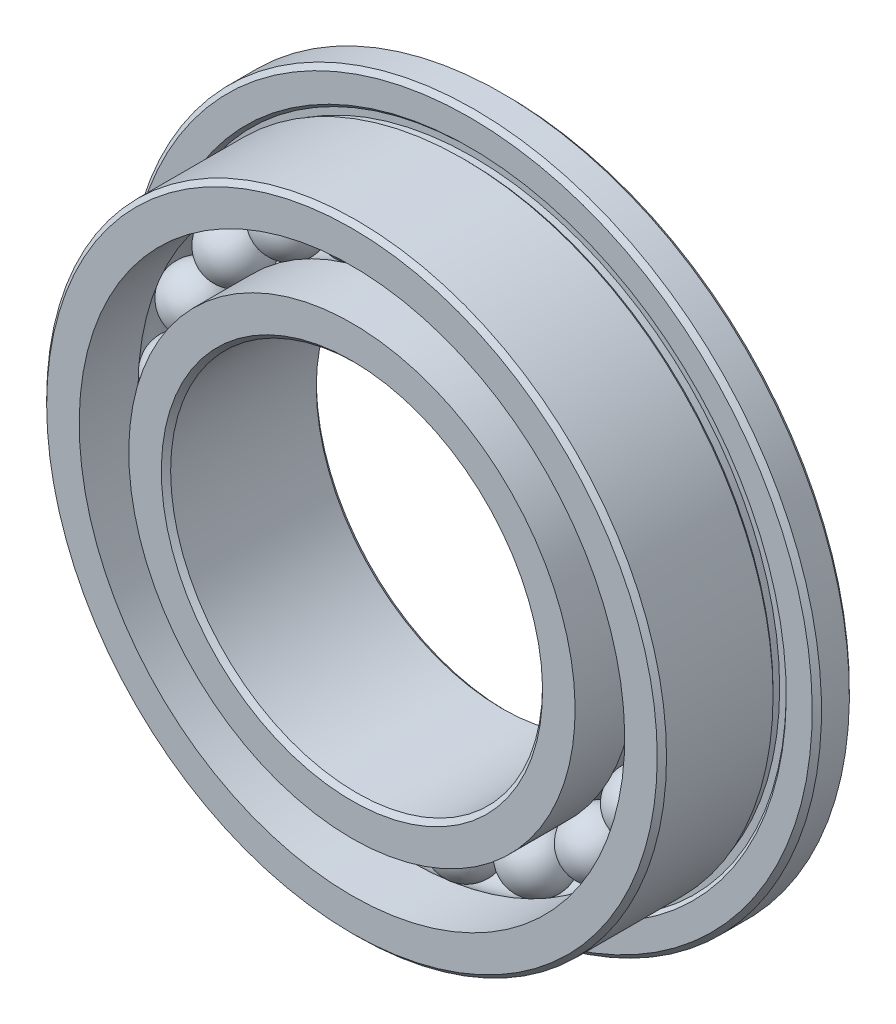
from build123d import *

# Parameters (mm, degrees)
FILLET1_SIZE      = 0.075
FILLET2_SIZE      = 0.075
CIRPATTERN3_COUNT = 21


with BuildPart() as part:
    # Sketch2 → Revolve1 (revolve)
    with BuildSketch(Plane(origin=(0, 0, 0), x_dir=(0, 0, -1), z_dir=(1, 0, 0)), mode=Mode.PRIVATE) as revolve1_sk:
        with BuildLine():
            Line((1.25, 5.6), (0.65, 5.6))
            Line((0.65, 5.6), (0.65, 5.106066017))
            Line((0.65, 5.106066017), (0.703033009, 5.053033009))
            Line((0.703033009, 5.053033009), (0.703033009, 4.946966991))
            Line((0.703033009, 4.946966991), (0.596966991, 4.946966991))
            Line((0.596966991, 4.946966991), (0.543933983, 5))
            Line((0.543933983, 5), (-1.25, 5))
            Line((-1.25, 5), (-1.25, 4.4))
            Line((-1.25, 4.4), (-0.3, 4.4))
            ThreePointArc((-0.3, 4.4), (0, 4.5), (0.3, 4.4))
            Line((0.3, 4.4), (1.25, 4.4))
            Line((1.25, 4.4), (1.25, 5.6))
        make_face()
        with BuildLine():
            Line((1.25, 3), (-1.25, 3))
            Line((-1.25, 3), (-1.25, 3.6))
            Line((-1.25, 3.6), (-0.3, 3.6))
            ThreePointArc((-0.3, 3.6), (0, 3.5), (0.3, 3.6))
            Line((0.3, 3.6), (1.25, 3.6))
            Line((1.25, 3.6), (1.25, 3))
        make_face()
    revolve(revolve1_sk.sketch.rotate(Axis((0, 0, 0), (0, 0, -1)), 180), axis=Axis((0, 0, 0), (0, 0, -1)))

    # Fillet1
    fillet1_edges = [part.edges().sort_by_distance(p)[0] for p in [
        (0, 5, 1.25),
        (0, 5.6, -1.25),
        (0, 5.6, -0.65),
    ]]
    chamfer(fillet1_edges, length=FILLET1_SIZE)

    # Fillet2
    fillet2_edges = [part.edges().sort_by_distance(p)[0] for p in [
        (0, 3, -1.25),
        (0, 3, 1.25),
    ]]
    chamfer(fillet2_edges, length=FILLET2_SIZE)


with BuildPart() as body_2:
    # Sketch7 → Revolve3 (revolve)
    with BuildSketch(Plane.XY):
        with BuildLine():
            Line((0, 4.5), (0, 3.5))
            ThreePointArc((0, 3.5), (-0.5, 4), (0, 4.5))
        make_face()
    revolve(axis=Axis((0, 4.5, 0), (0, -1, 0)))


with BuildPart() as cirpattern3_1:
    # CirPattern3: pattern copy
    add(body_2.part.rotate(Axis((0, 0, 0), (0, 0, 1)), 1 * 360 / CIRPATTERN3_COUNT))


with BuildPart() as cirpattern3_2:
    # CirPattern3: pattern copy
    add(body_2.part.rotate(Axis((0, 0, 0), (0, 0, 1)), 2 * 360 / CIRPATTERN3_COUNT))


with BuildPart() as cirpattern3_3:
    # CirPattern3: pattern copy
    add(body_2.part.rotate(Axis((0, 0, 0), (0, 0, 1)), 3 * 360 / CIRPATTERN3_COUNT))


with BuildPart() as cirpattern3_4:
    # CirPattern3: pattern copy
    add(body_2.part.rotate(Axis((0, 0, 0), (0, 0, 1)), 4 * 360 / CIRPATTERN3_COUNT))


with BuildPart() as cirpattern3_5:
    # CirPattern3: pattern copy
    add(body_2.part.rotate(Axis((0, 0, 0), (0, 0, 1)), 5 * 360 / CIRPATTERN3_COUNT))


with BuildPart() as cirpattern3_6:
    # CirPattern3: pattern copy
    add(body_2.part.rotate(Axis((0, 0, 0), (0, 0, 1)), 6 * 360 / CIRPATTERN3_COUNT))


with BuildPart() as cirpattern3_7:
    # CirPattern3: pattern copy
    add(body_2.part.rotate(Axis((0, 0, 0), (0, 0, 1)), 7 * 360 / CIRPATTERN3_COUNT))


with BuildPart() as cirpattern3_8:
    # CirPattern3: pattern copy
    add(body_2.part.rotate(Axis((0, 0, 0), (0, 0, 1)), 8 * 360 / CIRPATTERN3_COUNT))


with BuildPart() as cirpattern3_9:
    # CirPattern3: pattern copy
    add(body_2.part.rotate(Axis((0, 0, 0), (0, 0, 1)), 9 * 360 / CIRPATTERN3_COUNT))


with BuildPart() as cirpattern3_10:
    # CirPattern3: pattern copy
    add(body_2.part.rotate(Axis((0, 0, 0), (0, 0, 1)), 10 * 360 / CIRPATTERN3_COUNT))


with BuildPart() as cirpattern3_11:
    # CirPattern3: pattern copy
    add(body_2.part.rotate(Axis((0, 0, 0), (0, 0, 1)), 11 * 360 / CIRPATTERN3_COUNT))


with BuildPart() as cirpattern3_12:
    # CirPattern3: pattern copy
    add(body_2.part.rotate(Axis((0, 0, 0), (0, 0, 1)), 12 * 360 / CIRPATTERN3_COUNT))


with BuildPart() as cirpattern3_13:
    # CirPattern3: pattern copy
    add(body_2.part.rotate(Axis((0, 0, 0), (0, 0, 1)), 13 * 360 / CIRPATTERN3_COUNT))


with BuildPart() as cirpattern3_14:
    # CirPattern3: pattern copy
    add(body_2.part.rotate(Axis((0, 0, 0), (0, 0, 1)), 14 * 360 / CIRPATTERN3_COUNT))


with BuildPart() as cirpattern3_15:
    # CirPattern3: pattern copy
    add(body_2.part.rotate(Axis((0, 0, 0), (0, 0, 1)), 15 * 360 / CIRPATTERN3_COUNT))


with BuildPart() as cirpattern3_16:
    # CirPattern3: pattern copy
    add(body_2.part.rotate(Axis((0, 0, 0), (0, 0, 1)), 16 * 360 / CIRPATTERN3_COUNT))


with BuildPart() as cirpattern3_17:
    # CirPattern3: pattern copy
    add(body_2.part.rotate(Axis((0, 0, 0), (0, 0, 1)), 17 * 360 / CIRPATTERN3_COUNT))


with BuildPart() as cirpattern3_18:
    # CirPattern3: pattern copy
    add(body_2.part.rotate(Axis((0, 0, 0), (0, 0, 1)), 18 * 360 / CIRPATTERN3_COUNT))


with BuildPart() as cirpattern3_19:
    # CirPattern3: pattern copy
    add(body_2.part.rotate(Axis((0, 0, 0), (0, 0, 1)), 19 * 360 / CIRPATTERN3_COUNT))


with BuildPart() as cirpattern3_20:
    # CirPattern3: pattern copy
    add(body_2.part.rotate(Axis((0, 0, 0), (0, 0, 1)), 20 * 360 / CIRPATTERN3_COUNT))


solid = Compound([part.part, body_2.part, cirpattern3_1.part, cirpattern3_2.part, cirpattern3_3.part, cirpattern3_4.part, cirpattern3_5.part, cirpattern3_6.part, cirpattern3_7.part, cirpattern3_8.part, cirpattern3_9.part, cirpattern3_10.part, cirpattern3_11.part, cirpattern3_12.part, cirpattern3_13.part, cirpattern3_14.part, cirpattern3_15.part, cirpattern3_16.part, cirpattern3_17.part, cirpattern3_18.part, cirpattern3_19.part, cirpattern3_20.part])
